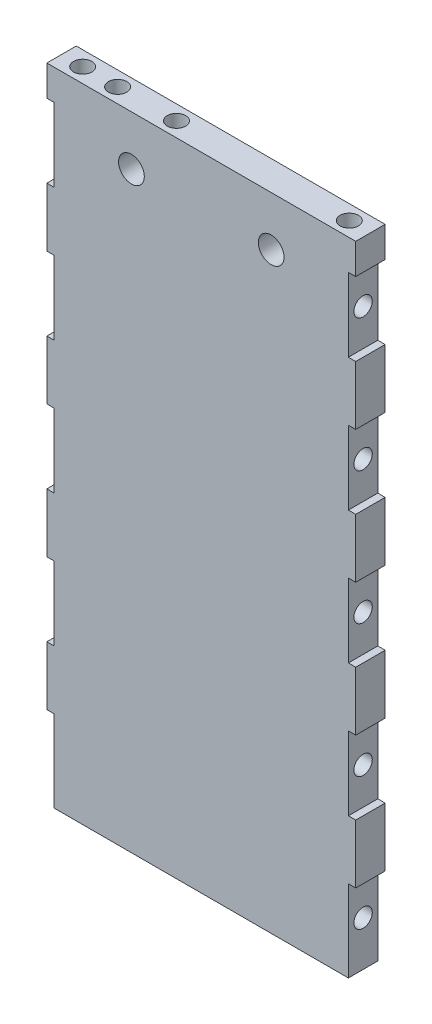
from build123d import *

# Parameters (mm, degrees)
BOSS_EXTRUDE1_DEPTH = 8
SKETCH2_R           = 2.5
CUT_EXTRUDE1_DEPTH  = 10
SKETCH3_R           = 2
CUT_EXTRUDE2_DEPTH  = 8
SKETCH4_R           = 2.5
CUT_EXTRUDE3_DEPTH  = 10
SKETCH5_R           = 2.5
CUT_EXTRUDE4_DEPTH  = 10
SKETCH6_R           = 3.5
CUT_EXTRUDE5_DEPTH  = 8


with BuildPart() as part:
    # Sketch1 → Boss-Extrude1 (new body)
    with BuildSketch(Plane.XY):
        Polygon((0, 38.2), (0, 22.2), (2, 22.2), (2, 0), (42, 0), (42, 174.5), (0, 174.5), (0, 166.2), (2, 166.2), (2, 146.2), (0, 146.2), (0, 130.2), (2, 130.2), (2, 110.2), (0, 110.2), (0, 94.2), (2, 94.2), (2, 74.2), (0, 74.2), (0, 58.2), (2, 58.2), (2, 38.2), align=None)
        Polygon((42, 174.5), (42, 0), (82, 0), (82, 22.2), (84, 22.2), (84, 38.2), (82, 38.2), (82, 58.2), (84, 58.2), (84, 74.2), (82, 74.2), (82, 94.2), (84, 94.2), (84, 110.2), (82, 110.2), (82, 130.2), (84, 130.2), (84, 146.2), (82, 146.2), (82, 166.2), (84, 166.2), (84, 174.5), align=None)
    extrude(amount=BOSS_EXTRUDE1_DEPTH)

    # Sketch2 → Cut-Extrude1 (cut)
    with BuildSketch(Plane.ZY.offset(-2)):
        with Locations(Location((4, 156.2, 0), (0, 0, 270))):
            Circle(SKETCH2_R)
        with Locations(Location((4, 120.2, 0), (0, 0, 270))):
            Circle(SKETCH2_R)
        with Locations(Location((4, 84.2, 0), (0, 0, 270))):
            Circle(SKETCH2_R)
        with Locations(Location((4, 48.2, 0), (0, 0, 270))):
            Circle(SKETCH2_R)
        with Locations(Location((4, 12.2, 0), (0, 0, 270))):
            Circle(SKETCH2_R)
    cut_extrude1 = extrude(amount=-CUT_EXTRUDE1_DEPTH, mode=Mode.SUBTRACT)

    # Mirror1: Cut-Extrude1 across plane
    add(cut_extrude1.mirror(Plane(origin=(42, 0, 0), x_dir=(0, 0, 1), z_dir=(1, 0, 0))), mode=Mode.SUBTRACT)

    # Sketch3 → Cut-Extrude2 (cut)
    with BuildSketch(Plane.XZ):
        with Locations(Location((42, 4, 0), (0, 0, 270))):
            Circle(SKETCH3_R)
        with Locations(Location((76, 4, 0), (0, 0, 270))):
            Circle(SKETCH3_R)
        with Locations(Location((8, 4, 0), (0, 0, 90))):
            Circle(SKETCH3_R)
    extrude(amount=-CUT_EXTRUDE2_DEPTH, mode=Mode.SUBTRACT)

    # Sketch4 → Cut-Extrude3 (cut)
    with BuildSketch(Plane(origin=(0, 174.5, 0), x_dir=(1, 0, 0), z_dir=(0, 1, 0))):
        with Locations(Location((5.75, -4, 0), (0, 0, 270))):
            Circle(SKETCH4_R)
        with Locations(Location((78.25, -4, 0), (0, 0, 90))):
            Circle(SKETCH4_R)
    extrude(amount=-CUT_EXTRUDE3_DEPTH, mode=Mode.SUBTRACT)

    # Sketch5 → Cut-Extrude4 (cut)
    with BuildSketch(Plane(origin=(0, 174.5, 0), x_dir=(1, 0, 0), z_dir=(0, 1, 0))):
        with Locations(Location((15.25, -4, 0), (0, 0, 270))):
            Circle(SKETCH5_R)
        with Locations(Location((31.25, -4, 0), (0, 0, 270))):
            Circle(SKETCH5_R)
    extrude(amount=-CUT_EXTRUDE4_DEPTH, mode=Mode.SUBTRACT)

    # Sketch6 → Cut-Extrude5 (cut)
    with BuildSketch(Plane.XY.offset(8)):
        with Locations((23, 161)):
            Circle(SKETCH6_R)
        with Locations(Location((61, 161, 0), (0, 0, 180))):
            Circle(SKETCH6_R)
    extrude(amount=-CUT_EXTRUDE5_DEPTH, mode=Mode.SUBTRACT)


solid = part.part
